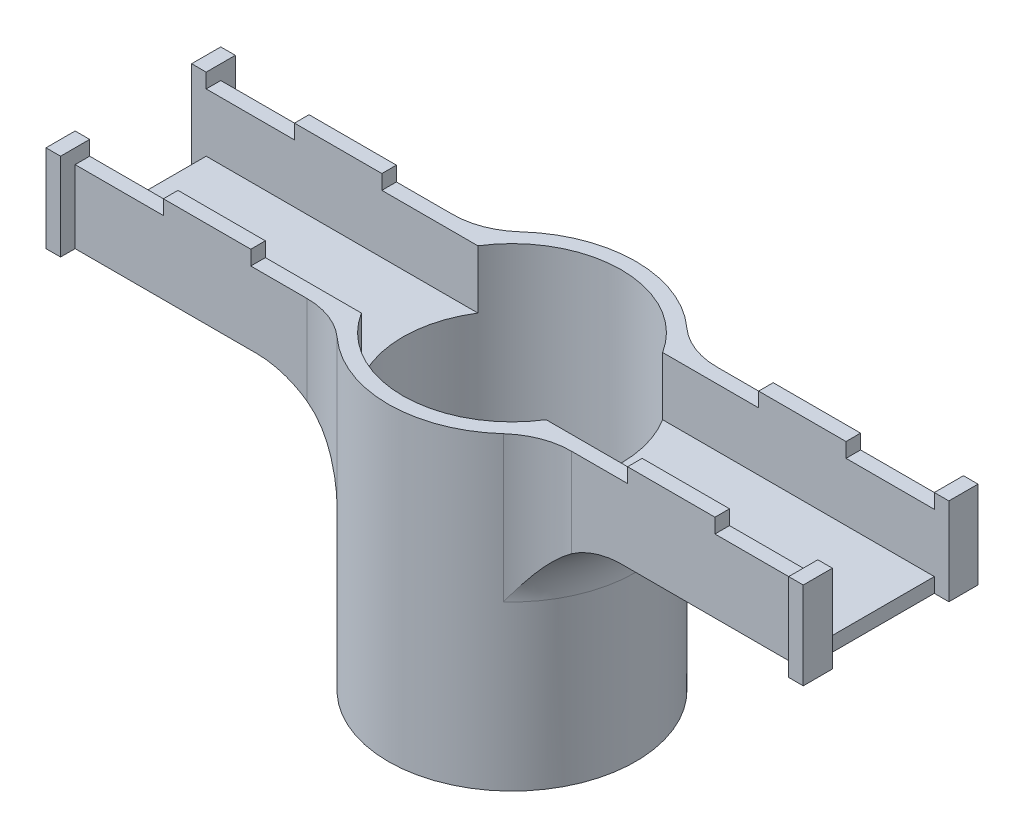
from build123d import *

# Parameters (mm, degrees)
SKETCH_1_R               = 17
SKETCH_1_R_2             = 7
SKETCH_1_R_3             = 1.6
EXTRUDE_1_DEPTH          = 2
EXTRUDE_START            = 40.5
SKETCH_2_R               = 17
SKETCH_2_R_2             = 15
EXTRUDE_2_DEPTH          = 40.5
EXTRUDE_3_REACH          = 82.114
EXTRUDE_3_END_RADIUS     = 17
SKETCH_5_W               = 4
SKETCH_5_H               = 12
EXTRUDE_4_DEPTH          = 2
CUT_EXTRUDE_1_REACH      = 83.143
SKETCH_6_W               = 16
SKETCH_6_H               = 8
SKETCH_7_W               = 12
SKETCH_7_H               = 2
EXTRUDE_5_DEPTH          = 2
MIRROR_2_COPY_1_SKETCH_W = 12
MIRROR_2_COPY_1_SKETCH_H = 2
MIRROR_2_COPY_1_DEPTH    = 2
MIRROR_2_COPY_2_SKETCH_W = 12
MIRROR_2_COPY_2_SKETCH_H = 2
MIRROR_2_COPY_2_DEPTH    = 2
FILLET_1_R               = 10


with BuildPart() as part:
    # 草图1 → 凸台-拉伸1 (new body)
    with BuildSketch(Plane(origin=(0, 0, 0), x_dir=(1, 0, 0), z_dir=(0, 1, 0))):
        with Locations(Location((0, 0, 0), (0, 0, 270))):
            Circle(SKETCH_1_R)
        with Locations(Location((0, 0, 0), (0, 0, 270))):
            Circle(SKETCH_1_R_2, mode=Mode.SUBTRACT)
        with Locations(Location((9.17629535, -2.458780928, 0), (0, 0, 270))):
            Circle(SKETCH_1_R_3, mode=Mode.SUBTRACT)
        with Locations(Location((-6.717514421, -6.717514421, 0), (0, 0, 270))):
            Circle(SKETCH_1_R_3, mode=Mode.SUBTRACT)
        with Locations(Location((-2.458780928, 9.17629535, 0), (0, 0, 270))):
            Circle(SKETCH_1_R_3, mode=Mode.SUBTRACT)
    extrude(amount=-EXTRUDE_1_DEPTH)

    # 草图2 → 凸台-拉伸2 (add)
    with BuildSketch(Plane(origin=(0, 0, 0), x_dir=(1, 0, 0), z_dir=(0, 1, 0)).offset(EXTRUDE_START)):
        with Locations(Location((0, 0, 0), (0, 0, 270))):
            Circle(SKETCH_2_R)
        with Locations(Location((0, 0, 0), (0, 0, 270))):
            Circle(SKETCH_2_R_2, mode=Mode.SUBTRACT)
    extrude(amount=-EXTRUDE_2_DEPTH)

    # 凸台-拉伸3: up to this cylinder (the profile starts outside it)
    extrude_3_end = Plane(origin=(0, 40.276393, 0), z_dir=(0, 1, 0)) * Cylinder(EXTRUDE_3_END_RADIUS, 199.228, mode=Mode.PRIVATE)
    # 草图4 → 凸台-拉伸3 (add, up to the surface)
    with BuildSketch(Plane(origin=(50, 0, 0), x_dir=(0, 0, -1), z_dir=(1, 0, 0)), mode=Mode.PRIVATE) as extrude_3_sk1:
        Polygon((-10, 40.5), (-8, 40.5), (-8, 32.5), (8, 32.5), (8, 40.5), (10, 40.5), (10, 30.5), (-10, 30.5), align=None)
    extrude_3_tool1 = extrude(extrude_3_sk1.sketch, amount=-EXTRUDE_3_REACH, mode=Mode.PRIVATE) - extrude_3_end
    extrude_3 = extrude_3_tool1.solids().sort_by_distance((50, 40.276393, 9))[0]
    add(extrude_3)

    # 草图5 → 凸台-拉伸4 (add)
    with BuildSketch(Plane(origin=(50, 0, 0), x_dir=(0, 0, -1), z_dir=(1, 0, 0))):
        with Locations((-10, 36.5)):
            Rectangle(SKETCH_5_W, SKETCH_5_H)
        with Locations((10, 36.5)):
            Rectangle(SKETCH_5_W, SKETCH_5_H)
    extrude_4 = extrude(amount=EXTRUDE_4_DEPTH)

    # 草图6 → 切除-拉伸1 (cut, up to next)
    with BuildSketch(Plane(origin=(50, 0, 0), x_dir=(0, 0, -1), z_dir=(1, 0, 0)), mode=Mode.PRIVATE) as cut_extrude_1_sk1:
        with Locations((0, 36.5)):
            Rectangle(SKETCH_6_W, SKETCH_6_H)
    cut_extrude_1_tool1 = extrude(cut_extrude_1_sk1.sketch, amount=-CUT_EXTRUDE_1_REACH, mode=Mode.PRIVATE) & part.part
    cut_extrude_1 = cut_extrude_1_tool1.solids().sort_by_distance((50, 36.5, 0))[0]
    add(cut_extrude_1, mode=Mode.SUBTRACT)

    # 草图7 → 凸台-拉伸5 (add)
    with BuildSketch(Plane(origin=(0, 40.5, 0), x_dir=(1, 0, 0), z_dir=(0, 1, 0))):
        with Locations((31.873863542, -9)):
            Rectangle(SKETCH_7_W, SKETCH_7_H)
    extrude_5 = extrude(amount=EXTRUDE_5_DEPTH)

    # 镜向1: 凸台-拉伸5 across plane
    add(extrude_5.mirror(Plane.XY))

    # 镜向2: 凸台-拉伸3, 凸台-拉伸4, 切除-拉伸1 across plane
    add(extrude_3.mirror(Plane(origin=(0, 0, 0), x_dir=(0, 0, 1), z_dir=(1, 0, 0))))
    add(extrude_4.mirror(Plane(origin=(0, 0, 0), x_dir=(0, 0, 1), z_dir=(1, 0, 0))))
    add(cut_extrude_1.mirror(Plane(origin=(0, 0, 0), x_dir=(0, 0, 1), z_dir=(1, 0, 0))), mode=Mode.SUBTRACT)

    # 镜向2 copy 1 sketch → 镜向2 copy 1 (add)
    with BuildSketch(Plane(origin=(0, 40.5, 0), x_dir=(-1, 0, 0), z_dir=(0, 1, 0))):
        with Locations((31.873863542, -9)):
            Rectangle(MIRROR_2_COPY_1_SKETCH_W, MIRROR_2_COPY_1_SKETCH_H)
    extrude(amount=MIRROR_2_COPY_1_DEPTH)

    # 镜向2 copy 2 sketch → 镜向2 copy 2 (add)
    with BuildSketch(Plane(origin=(0, 40.5, 0), x_dir=(-1, 0, 0), z_dir=(0, 1, 0))):
        with Locations((31.873863542, 9)):
            Rectangle(MIRROR_2_COPY_2_SKETCH_W, MIRROR_2_COPY_2_SKETCH_H)
    extrude(amount=MIRROR_2_COPY_2_DEPTH)

    # 圆角1
    fillet_1_edges = [part.edges().sort_by_distance(p)[0] for p in [
        (-13.747727085, 35.5, 10),
        (-13.747727085, 35.5, -10),
        (-17, 30.5, 0),
        (13.747727085, 35.5, 10),
        (13.747727085, 35.5, -10),
        (17, 30.5, 0),
    ]]
    fillet(fillet_1_edges, radius=FILLET_1_R)


solid = part.part
